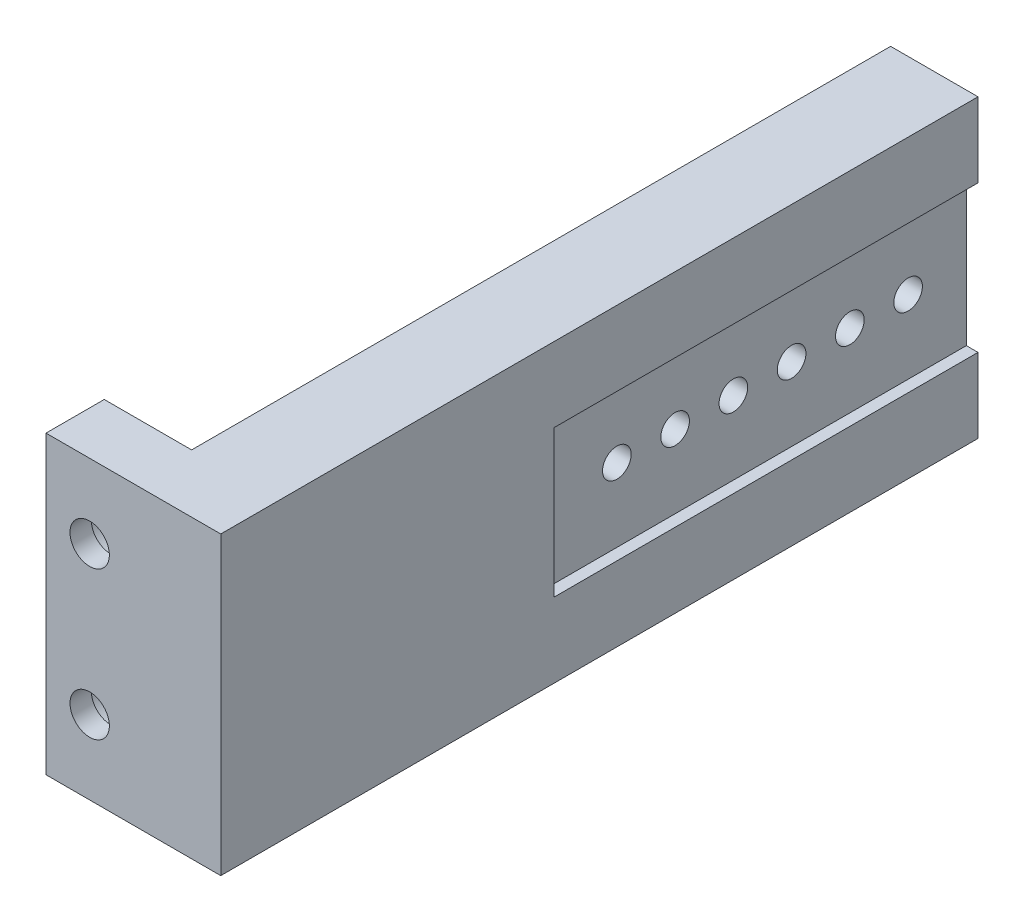
from build123d import *

# Parameters (mm, degrees)
SKETCH1_W                                        = 15
SKETCH1_H                                        = 130
SKETCH1_H_2                                      = 10
BOSS_EXTRUDE1_DEPTH                              = 50.8
CBORE_FOR_1_4_SOCKET_HEAD_CAP_SCREW1_D           = 6.7564
CBORE_FOR_1_4_SOCKET_HEAD_CAP_SCREW1_CBORE_D     = 11.1125
CBORE_FOR_1_4_SOCKET_HEAD_CAP_SCREW1_CBORE_DEPTH = 6.35
F_8_CLEARANCE_HOLE2_D                            = 4.9149
LPATTERN1_COUNT                                  = 3
LPATTERN1_PITCH                                  = 20
SKETCH10_W                                       = 72.8
SKETCH10_H                                       = 25.2
CUT_EXTRUDE1_DEPTH                               = 2
SKETCH13_W                                       = 15
SKETCH13_H                                       = 5.4
BOSS_EXTRUDE2_DEPTH                              = 10
DRAFT1_ANGLE                                     = 60


with BuildPart() as part:
    # Sketch1 → Boss-Extrude1 (new body)
    with BuildSketch(Plane(origin=(0, 0, 0), x_dir=(1, 0, 0), z_dir=(0, 1, 0))):
        with Locations((-75.402654867, 8.513274336)):
            Rectangle(SKETCH1_W, SKETCH1_H)
        with Locations((-90.402654867, -51.486725664)):
            Rectangle(SKETCH1_W, SKETCH1_H_2)
    extrude(amount=BOSS_EXTRUDE1_DEPTH)

    # CBORE for 1/4 Socket Head Cap Screw1 (through all)
    with Locations(Plane(origin=(0, 0, 46.486725664), x_dir=(-1, 0, 0), z_dir=(0, 0, -1))):
        with Locations((90.402654867, 12.7), (90.402654867, 38.1)):
            CounterBoreHole(CBORE_FOR_1_4_SOCKET_HEAD_CAP_SCREW1_D / 2, CBORE_FOR_1_4_SOCKET_HEAD_CAP_SCREW1_CBORE_D / 2, CBORE_FOR_1_4_SOCKET_HEAD_CAP_SCREW1_CBORE_DEPTH)

    # #8 Clearance Hole2 (through all)
    with Locations(Plane(origin=(-67.902654867, 0, 0), x_dir=(0, 0, -1), z_dir=(1, 0, 0))):
        with Locations((63.513274336, 25.4), (53.513274336, 25.4)):
            f_8_clearance_hole2 = Hole(F_8_CLEARANCE_HOLE2_D / 2)

    # LPattern1: #8 Clearance Hole2 ×3
    with Locations(*[(0, 0, i * LPATTERN1_PITCH) for i in range(1, LPATTERN1_COUNT)]):
        add(f_8_clearance_hole2, mode=Mode.SUBTRACT)

    # Sketch10 → Cut-Extrude1 (cut)
    with BuildSketch(Plane(origin=(-67.902654867, 0, 0), x_dir=(0, 0, -1), z_dir=(1, 0, 0))):
        with Locations((37.113274336, 25.4)):
            Rectangle(SKETCH10_W, SKETCH10_H)
    extrude(amount=-CUT_EXTRUDE1_DEPTH, mode=Mode.SUBTRACT)

    # Sketch13 → Boss-Extrude2 (add)
    with BuildSketch(Plane(origin=(0, 0, 46.486725664), x_dir=(-1, 0, 0), z_dir=(0, 0, -1))):
        with Locations((90.402654867, 25.4)):
            Rectangle(SKETCH13_W, SKETCH13_H)
    extrude(amount=BOSS_EXTRUDE2_DEPTH)

    # Draft1
    draft1_faces = [part.faces().sort_by_distance(p)[0] for p in [
        (-90.402654867, 25.4, 36.486725664),
    ]]
    draft(draft1_faces, Plane(origin=(-97.902654867, 50.8, 0), x_dir=(0, 0, -1), z_dir=(-1, 0, 0)), DRAFT1_ANGLE)


solid = part.part
